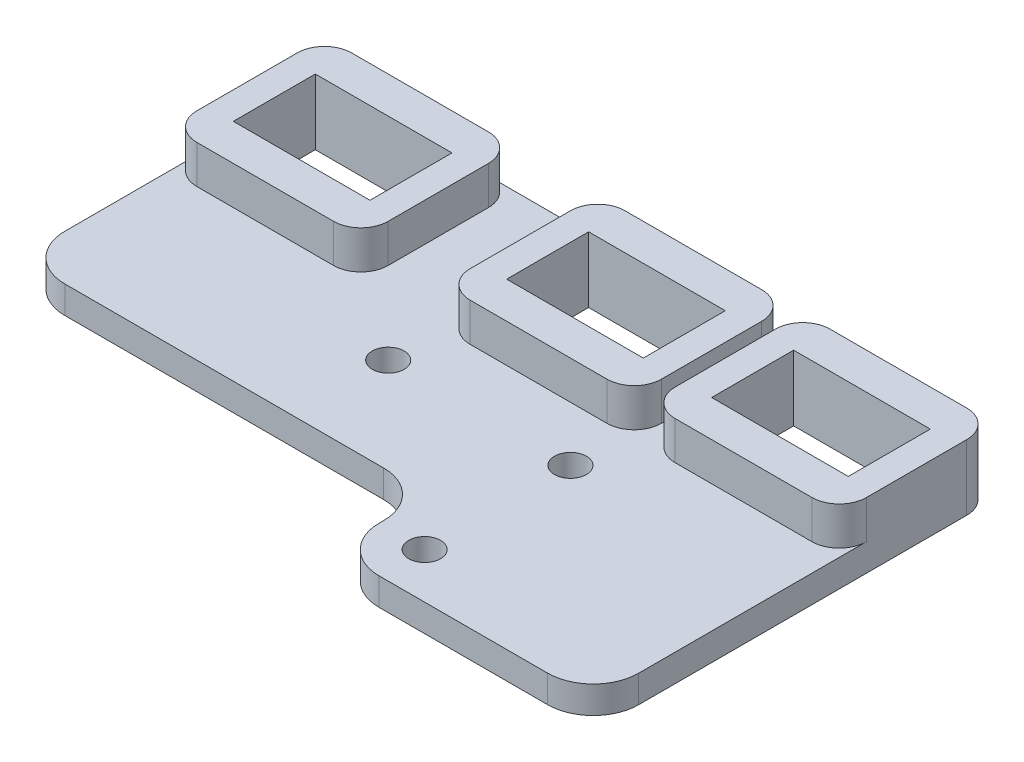
from build123d import *

# Parameters (mm, degrees)
SKETCH_1_W          = 21
SKETCH_1_H          = 17
SKETCH_1_W_2        = 15
SKETCH_1_H_2        = 9
EXTRUDE_1_DEPTH     = 4.2
EXTRUDE_1_2_DEPTH   = 4.2
EXTRUDE_1_3_DEPTH   = 4.2
SKETCH_2_W          = 73.5
SKETCH_2_H          = 44
SKETCH_2_R          = 1.75
SKETCH_2_W_2        = 15
SKETCH_2_H_2        = 9
EXTRUDE_2_DEPTH     = 3
FILLET_1_R          = 3
SKETCH_3_W          = 45
SKETCH_3_H          = 10.5
CUT_EXTRUDE_1_DEPTH = 56.196376693
FILLET_2_R          = 5


with BuildPart() as part:
    # 草图1 → 凸台-拉伸1 (new body)
    with BuildSketch(Plane(origin=(0, 0, 0), x_dir=(1, 0, 0), z_dir=(0, 1, 0))):
        with Locations((13, 14.5)):
            Rectangle(SKETCH_1_W, SKETCH_1_H)
        with Locations((13, 14.5)):
            Rectangle(SKETCH_1_W_2, SKETCH_1_H_2, mode=Mode.SUBTRACT)
    extrude(amount=EXTRUDE_1_DEPTH)



with BuildPart() as body_2:
    # 草图1 → Extrude 1 2 (new body)
    with BuildSketch(Plane(origin=(0, 0, 0), x_dir=(1, 0, 0), z_dir=(0, 1, 0))):
        with Locations((-9.5, 14.5)):
            Rectangle(SKETCH_1_W, SKETCH_1_H)
        with Locations((-9.5, 14.5)):
            Rectangle(SKETCH_1_W_2, SKETCH_1_H_2, mode=Mode.SUBTRACT)
    extrude(amount=EXTRUDE_1_2_DEPTH)


with BuildPart() as body_3:
    # 草图1 → Extrude 1 3 (new body)
    with BuildSketch(Plane(origin=(0, 0, 0), x_dir=(1, 0, 0), z_dir=(0, 1, 0))):
        with Locations((-39.5, 14.5)):
            Rectangle(SKETCH_1_W, SKETCH_1_H)
        with Locations((-39.5, 14.5)):
            Rectangle(SKETCH_1_W_2, SKETCH_1_H_2, mode=Mode.SUBTRACT)
    extrude(amount=EXTRUDE_1_3_DEPTH)


with BuildPart() as part_1:
    add(part.part)

    add(body_2.part)  # 凸台-拉伸2 merges body 2

    add(body_3.part)  # 凸台-拉伸2 merges body 3
    # 草图2 → 凸台-拉伸2 (add)
    with BuildSketch(Plane.XZ):
        with Locations((-13.25, -1)):
            Rectangle(SKETCH_2_W, SKETCH_2_H)
        with Locations(Location((0, 0, 0), (0, 0, 270))):
            Circle(SKETCH_2_R, mode=Mode.SUBTRACT)
        with Locations(Location((0, 16, 0), (0, 0, 270))):
            Circle(SKETCH_2_R, mode=Mode.SUBTRACT)
        with Locations(Location((-20, 0, 0), (0, 0, 270))):
            Circle(SKETCH_2_R, mode=Mode.SUBTRACT)
        with Locations((-39.5, -14.5)):
            Rectangle(SKETCH_2_W_2, SKETCH_2_H_2, mode=Mode.SUBTRACT)
        with Locations((-9.5, -14.5)):
            Rectangle(SKETCH_2_W_2, SKETCH_2_H_2, mode=Mode.SUBTRACT)
        with Locations((13, -14.5)):
            Rectangle(SKETCH_2_W_2, SKETCH_2_H_2, mode=Mode.SUBTRACT)
    extrude(amount=EXTRUDE_2_DEPTH)

    # 圆角1
    fillet_1_edges = [part_1.edges().sort_by_distance(p)[0] for p in [
        (1, 2.1, -23),
        (-20, 2.1, -23),
        (-20, 2.1, -6),
        (1, 2.1, -6),
        (-29, 2.1, -23),
        (-50, 2.1, -6),
        (-29, 2.1, -6),
        (-50, 0.6, -23),
        (23.5, 2.1, -6),
        (2.5, 2.1, -6),
        (2.5, 2.1, -23),
        (23.5, 0.6, -23),
    ]]
    fillet(fillet_1_edges, radius=FILLET_1_R)

    # 草图3 → 切除-拉伸1 (cut, through all)
    with BuildSketch(Plane(origin=(0, 0, 0), x_dir=(1, 0, 0), z_dir=(0, 1, 0))):
        with Locations((-27.5, -15.75)):
            Rectangle(SKETCH_3_W, SKETCH_3_H)
    extrude(amount=-CUT_EXTRUDE_1_DEPTH, mode=Mode.SUBTRACT)

    # 圆角2
    fillet_2_edges = [part_1.edges().sort_by_distance(p)[0] for p in [
        (-50, -1.5, 10.5),
        (-5, -1.5, 10.5),
        (-5, -1.5, 21),
        (23.5, -1.5, 21),
    ]]
    fillet(fillet_2_edges, radius=FILLET_2_R)


solid = part_1.part
